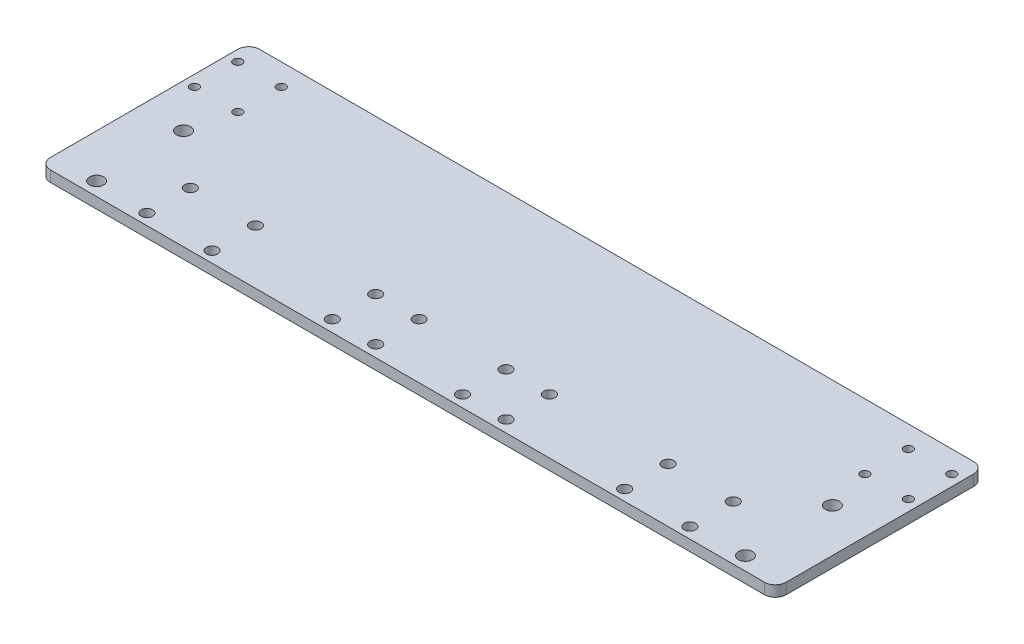
from build123d import *

# Parameters (mm, degrees)
SKETCH_1_R          = 2.6
SKETCH_1_R_2        = 1.6
SKETCH_1_R_3        = 1.600000005
EXTRUDE_1_DEPTH     = 4
SKETCH_2_R          = 2.1
CUT_EXTRUDE_1_DEPTH = 10
SKETCH_3_R          = 2.1
CUT_EXTRUDE_2_DEPTH = 10


with BuildPart() as part:
    # 草图1 → 凸台-拉伸1 (new body)
    with BuildSketch(Plane(origin=(0, 0, 0), x_dir=(1, 0, 0), z_dir=(0, 1, 0))):
        with BuildLine():
            Line((43.366933006, 50.318582259), (43.366933006, 19.318582258))
            Line((43.366933006, 19.318582258), (43.366933006, -18.681417742))
            ThreePointArc((43.366933006, -18.681417742), (42.19536013, -21.509844867), (39.366933005, -22.681417742))
            Line((39.366933005, -22.681417742), (-223.633066993, -22.681417742))
            ThreePointArc((-223.633066993, -22.681417742), (-226.461494119, -21.509844867), (-227.633066994, -18.681417742))
            Line((-227.633066994, -18.681417742), (-227.633066994, 19.318582258))
            Line((-227.633066994, 19.318582258), (-227.633066994, 50.318582259))
            ThreePointArc((-227.633066994, 50.318582259), (-226.461494119, 53.147009385), (-223.633066993, 54.31858226))
            Line((-223.633066993, 54.31858226), (39.366933005, 54.31858226))
            ThreePointArc((39.366933005, 54.31858226), (42.19536013, 53.147009385), (43.366933006, 50.318582259))
        make_face()
        with Locations(Location((-211.63306699, 14.318582258, 0), (0, 0, 90))):
            Circle(SKETCH_1_R, mode=Mode.SUBTRACT)
        with Locations(Location((-211.63306699, -17.681417742, 0), (0, 0, 90))):
            Circle(SKETCH_1_R, mode=Mode.SUBTRACT)
        with Locations(Location((27.36693301, -17.681417742, 0), (0, 0, 270))):
            Circle(SKETCH_1_R, mode=Mode.SUBTRACT)
        with Locations(Location((-207.63306699, 30.318582258, 0), (0, 0, 270))):
            Circle(SKETCH_1_R_2, mode=Mode.SUBTRACT)
        with Locations(Location((-207.63306699, 46.31858226, 0), (0, 0, 90))):
            Circle(SKETCH_1_R_2, mode=Mode.SUBTRACT)
        with Locations(Location((-223.63306699, 30.318582258, 0), (0, 0, 270))):
            Circle(SKETCH_1_R_2, mode=Mode.SUBTRACT)
        with Locations(Location((-223.63306699, 46.31858226, 0), (0, 0, 90))):
            Circle(SKETCH_1_R_2, mode=Mode.SUBTRACT)
        with Locations(Location((27.36693301, 14.318582258, 0), (0, 0, 270))):
            Circle(SKETCH_1_R, mode=Mode.SUBTRACT)
        with Locations(Location((39.366933005, 30.318582258, 0), (0, 0, 90))):
            Circle(SKETCH_1_R_3, mode=Mode.SUBTRACT)
        with Locations(Location((23.36693301, 30.318582258, 0), (0, 0, 90))):
            Circle(SKETCH_1_R_2, mode=Mode.SUBTRACT)
        with Locations(Location((39.366933005, 46.31858226, 0), (0, 0, 270))):
            Circle(SKETCH_1_R_3, mode=Mode.SUBTRACT)
        with Locations(Location((23.36693301, 46.31858226, 0), (0, 0, 270))):
            Circle(SKETCH_1_R_2, mode=Mode.SUBTRACT)
    extrude(amount=EXTRUDE_1_DEPTH)

    # 草图2 → 切除-拉伸1 (cut)
    with BuildSketch(Plane(origin=(0, 4, 0), x_dir=(1, 0, 0), z_dir=(0, 1, 0))):
        with Locations(Location((-124.133066994, -2.381417742, 0), (0, 0, 90))):
            Circle(SKETCH_2_R)
        with Locations(Location((-124.133066994, -18.381417742, 0), (0, 0, 90))):
            Circle(SKETCH_2_R)
        with Locations(Location((-108.133066994, -18.381417742, 0), (0, 0, 90))):
            Circle(SKETCH_2_R)
        with Locations(Location((-108.133066994, -2.381417742, 0), (0, 0, 90))):
            Circle(SKETCH_2_R)
        with Locations(Location((-76.133066994, -2.381417742, 0), (0, 0, 270))):
            Circle(SKETCH_2_R)
        with Locations(Location((-76.133066994, -18.381417742, 0), (0, 0, 270))):
            Circle(SKETCH_2_R)
        with Locations(Location((-60.133066994, -18.381417742, 0), (0, 0, 270))):
            Circle(SKETCH_2_R)
        with Locations(Location((-60.133066994, -2.381417742, 0), (0, 0, 270))):
            Circle(SKETCH_2_R)
    extrude(amount=-CUT_EXTRUDE_1_DEPTH, mode=Mode.SUBTRACT)

    # 草图3 → 切除-拉伸2 (cut)
    with BuildSketch(Plane(origin=(0, 4, 0), x_dir=(1, 0, 0), z_dir=(0, 1, 0))):
        with Locations(Location((7.866933006, -18.681417742, 0), (0, 0, 270))):
            Circle(SKETCH_3_R)
        with Locations(Location((-16.133066994, -18.681417742, 0), (0, 0, 270))):
            Circle(SKETCH_3_R)
        with Locations(Location((7.866933006, -2.681417742, 0), (0, 0, 270))):
            Circle(SKETCH_3_R)
        with Locations(Location((-16.133066994, -2.681417742, 0), (0, 0, 270))):
            Circle(SKETCH_3_R)
        with Locations(Location((-168.133066994, -18.681417742, 0), (0, 0, 90))):
            Circle(SKETCH_3_R)
        with Locations(Location((-168.133066994, -2.681417742, 0), (0, 0, 90))):
            Circle(SKETCH_3_R)
        with Locations(Location((-192.133066994, -18.681417742, 0), (0, 0, 90))):
            Circle(SKETCH_3_R)
        with Locations(Location((-192.133066994, -2.681417742, 0), (0, 0, 90))):
            Circle(SKETCH_3_R)
    extrude(amount=-CUT_EXTRUDE_2_DEPTH, mode=Mode.SUBTRACT)


solid = part.part
